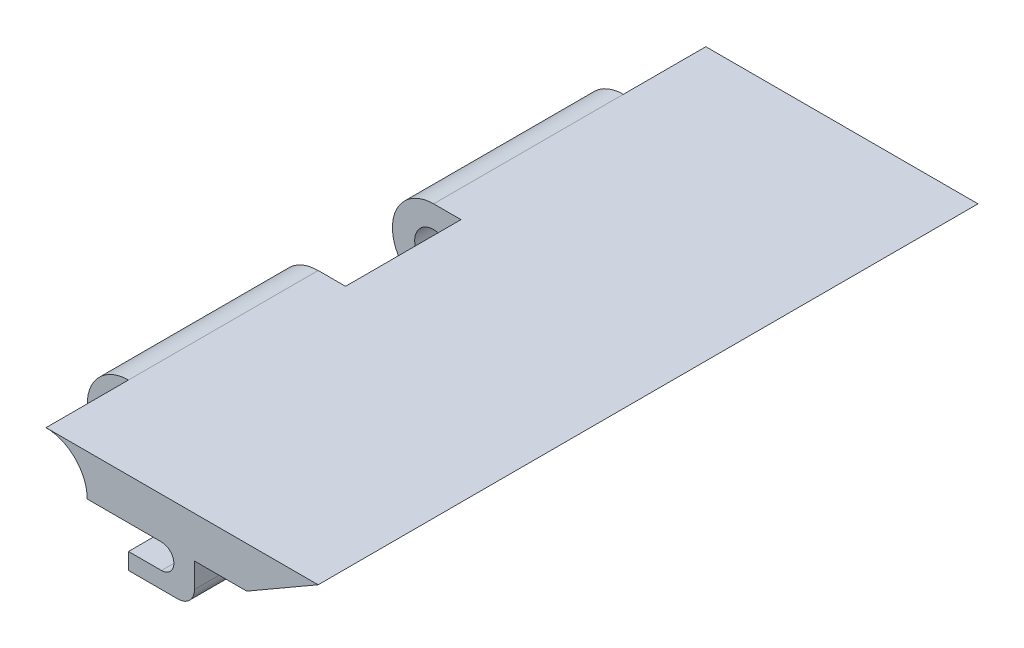
from build123d import *

# Parameters (mm, degrees)
SKETCH_1_R          = 1.15
EXTRUDE_1_DEPTH     = 20
EXTRUDE_2_DEPTH     = 20
SKETCH_5_R          = 3
CUT_EXTRUDE_2_DEPTH = 3.5
CUT_EXTRUDE_START   = -5
SKETCH_6_R          = 2.5
CUT_EXTRUDE_3_DEPTH = 5
SKETCH_7_R          = 2.5
CUT_EXTRUDE_4_DEPTH = 5
SKETCH_10_W         = 9.669872981
SKETCH_10_H         = 3
CUT_EXTRUDE_5_DEPTH = 3


with BuildPart() as part:
    # 草图1 → 凸台-拉伸1 (new, symmetric)
    with BuildSketch(Plane.XY):
        with BuildLine():
            Line((2.5, 0), (12.169872981, 0))
            Line((12.169872981, 0), (16.5, 2.5))
            Line((16.5, 2.5), (0, 2.5))
            ThreePointArc((0, 2.5), (-1.767766953, -1.767766953), (2.5, 0))
        make_face()
        Circle(SKETCH_1_R, mode=Mode.SUBTRACT)
    extrude(amount=EXTRUDE_1_DEPTH, both=True)

    # 草图4 → 凸台-拉伸2 (add, symmetric)
    with BuildSketch(Plane.XY):
        with BuildLine():
            Line((7, -1.5), (5, -1.5))
            Line((5, -1.5), (5, -2.5))
            Line((5, -2.5), (8, -2.5))
            ThreePointArc((8, -2.5), (8.707106781, -2.207106781), (9, -1.5))
            Line((9, -1.5), (9, 0))
            Line((9, 0), (7, 0))
            ThreePointArc((7, 0), (7.75, -0.75), (7, -1.5))
        make_face()
    extrude(amount=EXTRUDE_2_DEPTH, both=True)

    # 草图5 → 切除-拉伸2 (cut, symmetric)
    with BuildSketch(Plane.XY):
        Circle(SKETCH_5_R)
    extrude(amount=CUT_EXTRUDE_2_DEPTH, both=True, mode=Mode.SUBTRACT)

    # 草图6 → 切除-拉伸3 (cut)
    with BuildSketch(Plane(origin=(0, 0, -20), x_dir=(-1, 0, 0), z_dir=(0, 0, -1)).offset(CUT_EXTRUDE_START)):
        Circle(SKETCH_6_R)
    extrude(amount=CUT_EXTRUDE_3_DEPTH, mode=Mode.SUBTRACT)

    # 草图7 → 切除-拉伸4 (cut)
    with BuildSketch(Plane.XY.offset(20)):
        Circle(SKETCH_7_R)
    extrude(amount=-CUT_EXTRUDE_4_DEPTH, mode=Mode.SUBTRACT)

    # 草图10 → 切除-拉伸5 (cut)
    with BuildSketch(Plane.XZ):
        with Locations((7.334936491, -13.5)):
            Rectangle(SKETCH_10_W, SKETCH_10_H)
        with Locations((7.334936491, 13.5)):
            Rectangle(SKETCH_10_W, SKETCH_10_H)
    extrude(amount=CUT_EXTRUDE_5_DEPTH, mode=Mode.SUBTRACT)


solid = part.part
